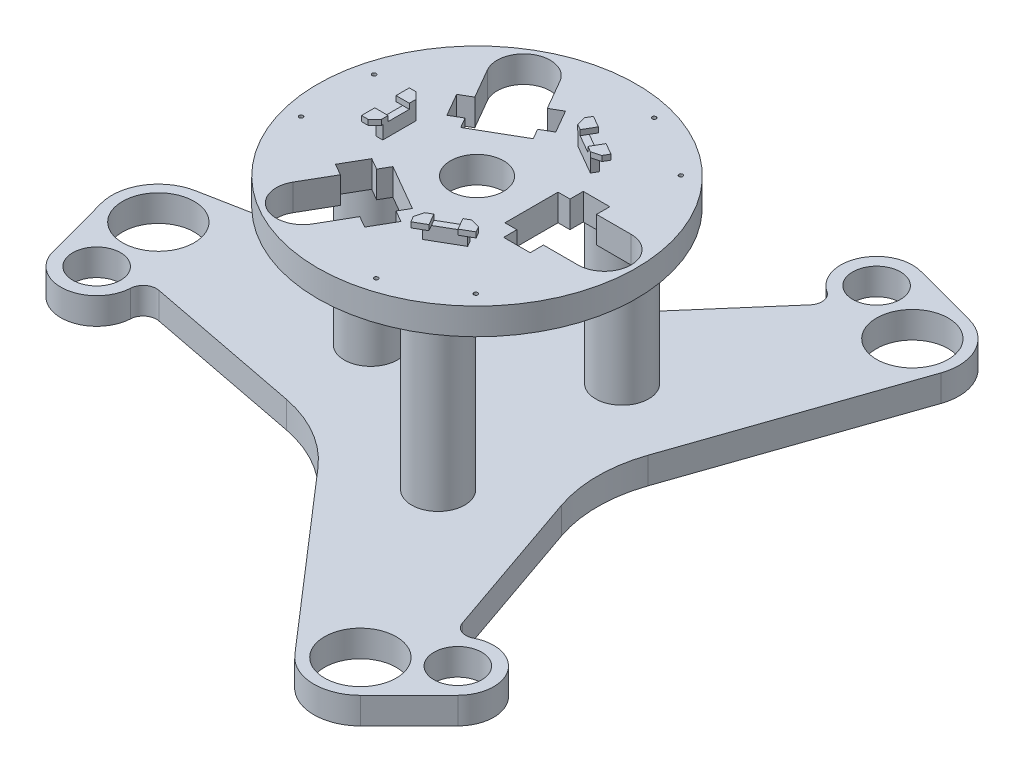
from build123d import *

# Parameters (mm, degrees)
SKETCH_1_R               = 120
EXTRUDE_1_DEPTH          = 20
CUT_EXTRUDE_1_DEPTH      = 171.880074906
CUT_EXTRUDE_1_DEPTH_BACK = 171.880074906
SKETCH_2_R               = 15
CUT_EXTRUDE_4_DEPTH      = 171.880074906
PATTERN_CIRCULAR_3_COUNT = 3
SKETCH_7_R               = 20
CUT_EXTRUDE_5_DEPTH      = 171.880074906
SKETCH_8_R               = 1.5
CUT_EXTRUDE_6_DEPTH      = 171.880074906
PATTERN_CIRCULAR_4_COUNT = 3
SKETCH_12_W              = 5
SKETCH_12_H              = 25
EXTRUDE_3_DEPTH          = 10
EXTRUDE_4_DEPTH          = 4
PATTERN_CIRCULAR_5_COUNT = 3
SKETCH_14_R              = 20
EXTRUDE_5_DEPTH          = 130
SKETCH_16_R              = 27
SKETCH_16_R_2            = 18
EXTRUDE_6_DEPTH          = 20


with BuildPart() as part:
    # 草图1 → 凸台-拉伸1 (new body)
    with BuildSketch(Plane(origin=(0, 0, 0), x_dir=(1, 0, 0), z_dir=(0, 1, 0))):
        Circle(SKETCH_1_R)
    extrude(amount=EXTRUDE_1_DEPTH)

    # 草图2 → 切除-拉伸1 (cut, two sides: drawn at the far end of the back side and taken through both)
    with BuildSketch(Plane(origin=(0, 20, 0), x_dir=(1, 0, 0), z_dir=(0, 1, 0)).offset(-CUT_EXTRUDE_1_DEPTH_BACK)):
        with Locations((60, 0)):
            Circle(SKETCH_2_R)
        with Locations((-30, -51.961524227)):
            Circle(SKETCH_2_R)
        with Locations((-30, 51.961524227)):
            Circle(SKETCH_2_R)
    extrude(amount=CUT_EXTRUDE_1_DEPTH + CUT_EXTRUDE_1_DEPTH_BACK, mode=Mode.SUBTRACT)

    # 草图6 → 切除-拉伸4 (cut, symmetric)
    with BuildSketch(Plane(origin=(0, 20, 0), x_dir=(1, 0, 0), z_dir=(0, 1, 0))):
        with BuildLine():
            Line((41, 20), (41, -20))
            Line((41, -20), (50, -20))
            Line((50, -20), (50, -30))
            Line((50, -30), (70, -30))
            Line((70, -30), (70, -20))
            Line((70, -20), (96, -20))
            ThreePointArc((96, -20), (116, 0), (96, 20))
            Line((96, 20), (70, 20))
            Line((70, 20), (70, 30))
            Line((70, 30), (50, 30))
            Line((50, 30), (50, 20))
            Line((50, 20), (41, 20))
        make_face()
    cut_extrude_4 = extrude(amount=CUT_EXTRUDE_4_DEPTH, both=True, mode=Mode.SUBTRACT)

    # 阵列(圆周)3: 切除-拉伸4 ×3 about axis
    pattern_circular_3_axis = Axis((0, 0, 0), (0, 1, 0))
    for i in range(1, PATTERN_CIRCULAR_3_COUNT):
        add(cut_extrude_4.rotate(pattern_circular_3_axis, i * 360 / PATTERN_CIRCULAR_3_COUNT), mode=Mode.SUBTRACT)

    # 草图7 → 切除-拉伸5 (cut, through all)
    with BuildSketch(Plane(origin=(0, 20, 0), x_dir=(1, 0, 0), z_dir=(0, 1, 0))):
        Circle(SKETCH_7_R)
    extrude(amount=-CUT_EXTRUDE_5_DEPTH, mode=Mode.SUBTRACT)

    # 草图8 → 切除-拉伸6 (cut, symmetric)
    with BuildSketch(Plane(origin=(0, 20, 0), x_dir=(1, 0, 0), z_dir=(0, 1, 0))):
        with Locations((-105, 27.5)):
            Circle(SKETCH_8_R)
        with Locations((-105, -27.5)):
            Circle(SKETCH_8_R)
    cut_extrude_6 = extrude(amount=CUT_EXTRUDE_6_DEPTH, both=True, mode=Mode.SUBTRACT)

    # 阵列(圆周)4: 切除-拉伸6 ×3 about axis
    pattern_circular_4_axis = Axis((0, 0, 0), (0, 1, 0))
    for i in range(1, PATTERN_CIRCULAR_4_COUNT):
        add(cut_extrude_6.rotate(pattern_circular_4_axis, i * 360 / PATTERN_CIRCULAR_4_COUNT), mode=Mode.SUBTRACT)

    # 草图12 → 凸台-拉伸3 (add)
    with BuildSketch(Plane(origin=(0, 20, 0), x_dir=(1, 0, 0), z_dir=(0, 1, 0))):
        with Locations((-61.5, 0.5)):
            Rectangle(SKETCH_12_W, SKETCH_12_H)
    extrude_3 = extrude(amount=EXTRUDE_3_DEPTH)

    # 草图13 → 凸台-拉伸4 (add)
    with BuildSketch(Plane(origin=(0, 30, 0), x_dir=(1, 0, 0), z_dir=(0, 1, 0))):
        Polygon((-69, 8), (-59, 8), (-59, 13), (-64, 18), (-69, 18), align=None)
        Polygon((-59, -13), (-59, -8), (-69, -8), (-69, -18), (-64, -18), align=None)
    extrude_4 = extrude(amount=EXTRUDE_4_DEPTH)

    # 阵列(圆周)5: 凸台-拉伸3, 凸台-拉伸4 ×3 about axis
    pattern_circular_5_axis = Axis((0, 0, 0), (0, 1, 0))
    add([extrude_3.rotate(pattern_circular_5_axis, i * 360 / PATTERN_CIRCULAR_5_COUNT) for i in range(1, PATTERN_CIRCULAR_5_COUNT)])
    add([extrude_4.rotate(pattern_circular_5_axis, i * 360 / PATTERN_CIRCULAR_5_COUNT) for i in range(1, PATTERN_CIRCULAR_5_COUNT)])

    # 草图14 → 凸台-拉伸5 (add)
    with BuildSketch(Plane.XZ):
        with Locations((-80, 0)):
            Circle(SKETCH_14_R)
        with Locations((40, 69.282032303)):
            Circle(SKETCH_14_R)
        with Locations((40, -69.282032303)):
            Circle(SKETCH_14_R)
    extrude(amount=EXTRUDE_5_DEPTH)


with BuildPart() as body_2:
    # 草图16 → 凸台-拉伸6 (new body)
    with BuildSketch(Plane.XZ.offset(130)):
        with BuildLine():
            Line((-246.628526186, -34.366591926), (-76.534367594, -67.173848074))
            ThreePointArc((-76.534367594, -67.173848074), (-45.473013838, -78.761570341), (-19.907075105, -99.867630635))
            Line((-19.907075105, -99.867630635), (59.388431747, -191.35406479))
            ThreePointArc((59.388431747, -191.35406479), (61.732420219, -199.31029348), (57.265218227, -206.298852936))
            ThreePointArc((57.265218227, -206.298852936), (47.25688302, -239.918973081), (78.903329246, -255.051114152))
            Line((78.903329246, -255.051114152), (129.032571935, -241.660482075))
            ThreePointArc((129.032571935, -241.660482075), (150.902234747, -224.279352448), (153.085639795, -196.429423166))
            Line((153.085639795, -196.429423166), (96.488172504, -32.409371588))
            ThreePointArc((96.488172504, -32.409371588), (91.01857973, 0.24922053), (96.513986941, 32.90347881))
            Line((96.513986941, 32.90347881), (136.023265352, 147.108922979))
            ThreePointArc((136.023265352, 147.108922979), (141.74156728, 153.116990887), (150.027438301, 152.742560206))
            ThreePointArc((150.027438301, 152.742560206), (184.147484028, 160.885147739), (181.429079496, 195.857844646))
            Line((181.429079496, 195.857844646), (144.7678306, 232.575726249))
            ThreePointArc((144.7678306, 232.575726249), (118.766674387, 242.824360272), (93.551921443, 230.769864938))
            Line((93.551921443, 230.769864938), (-19.761744948, 100.035303917))
            ThreePointArc((-19.761744948, 100.035303917), (-45.293458555, 78.949012527), (-76.311425368, 67.356522759))
            Line((-76.311425368, 67.356522759), (-195.406074797, 44.288240703))
            ThreePointArc((-195.406074797, 44.288240703), (-203.468582255, 46.228994799), (-207.29421735, 53.586648575))
            ThreePointArc((-207.29421735, 53.586648575), (-231.419480362, 79.035427258), (-260.332408742, 59.193269506))
            Line((-260.332408742, 59.193269506), (-273.800402536, 9.084755826))
            ThreePointArc((-273.800402536, 9.084755826), (-269.675401847, -18.557222994), (-246.628526186, -34.366591926))
        make_face()
        with Locations((-240, 0)):
            Circle(SKETCH_16_R, mode=Mode.SUBTRACT)
        with Locations((120, 207.846096908)):
            Circle(SKETCH_16_R, mode=Mode.SUBTRACT)
        with Locations((120, -207.846096908)):
            Circle(SKETCH_16_R, mode=Mode.SUBTRACT)
        with Locations((71.935345182, -228.965731308)):
            Circle(SKETCH_16_R_2, mode=Mode.SUBTRACT)
        with Locations((-234.2578125, 52.185029297)):
            Circle(SKETCH_16_R_2, mode=Mode.SUBTRACT)
        with Locations((162.322467318, 176.780702012)):
            Circle(SKETCH_16_R_2, mode=Mode.SUBTRACT)
    extrude(amount=EXTRUDE_6_DEPTH)


solid = Compound([part.part, body_2.part])
